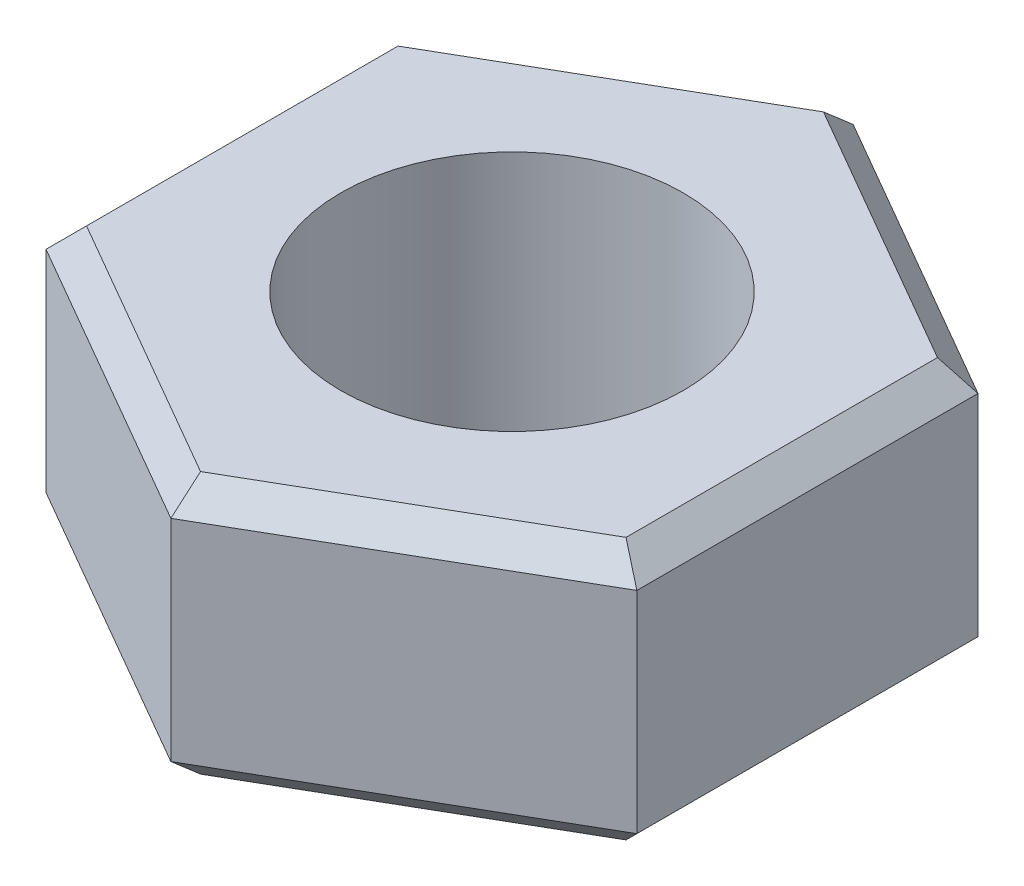
from build123d import *

# Parameters (mm, degrees)
SKETCH_1_R      = 2
EXTRUDE_1_DEPTH = 3.06
CHAMFER_1_SIZE  = 0.3


with BuildPart() as part:
    # 草图1 → 凸台-拉伸1 (new body)
    with BuildSketch(Plane(origin=(0, 0, 0), x_dir=(1, 0, 0), z_dir=(0, 1, 0))):
        Polygon((0, 3.983716857), (-3.45, 1.991858429), (-3.45, -1.991858429), (0, -3.983716857), (3.45, -1.991858429), (3.45, 1.991858429), align=None)
        with Locations(Location((0, 0, 0), (0, 0, 270))):
            Circle(SKETCH_1_R, mode=Mode.SUBTRACT)
    extrude(amount=EXTRUDE_1_DEPTH)

    # 倒角1
    chamfer_1_edges = [part.edges().sort_by_distance(p)[0] for p in [
        (-3.45, 3.06, 0),
        (-1.725, 3.06, 2.987787643),
        (1.725, 3.06, 2.987787643),
        (3.45, 3.06, 0),
        (1.725, 3.06, -2.987787643),
        (3.45, 0, 0),
        (1.725, 0, 2.987787643),
        (-1.725, 0, 2.987787643),
        (-1.725, 3.06, -2.987787643),
        (-3.45, 0, 0),
        (-1.725, 0, -2.987787643),
        (1.725, 0, -2.987787643),
    ]]
    chamfer(chamfer_1_edges, length=CHAMFER_1_SIZE)


solid = part.part
